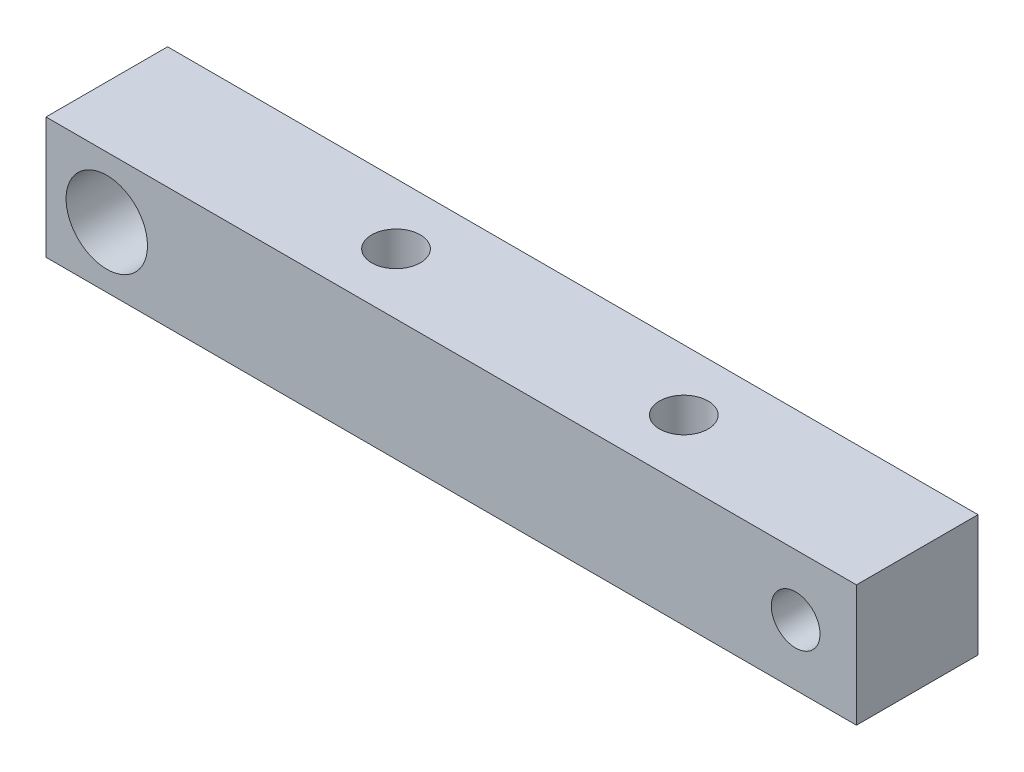
from build123d import *

# Parameters (mm, degrees)
SKETCH_1_W          = 100
SKETCH_1_H          = 15
SKETCH_1_R          = 3
SKETCH_1_R_2        = 5.021699513
EXTRUDE_1_DEPTH     = 15
CUT_EXTRUDE_1_REACH = 94.083
SKETCH_2_R          = 3


with BuildPart() as part:
    # 草圖1 → 填料-伸長1 (new body)
    with BuildSketch(Plane.XY):
        with Locations((39.606552155, 35.683485423)):
            Rectangle(SKETCH_1_W, SKETCH_1_H)
        with Locations((82.106552155, 35.683485423)):
            Circle(SKETCH_1_R, mode=Mode.SUBTRACT)
        with Locations((-2.893447845, 35.683485423)):
            Circle(SKETCH_1_R_2, mode=Mode.SUBTRACT)
    extrude(amount=EXTRUDE_1_DEPTH)

    # 草圖2 → 除料-伸長1 (cut, up to next)
    with BuildSketch(Plane.XZ.offset(-28.183485423), mode=Mode.PRIVATE) as cut_extrude_1_sk1:
        with Locations((60.806805045, 7.5)):
            Circle(SKETCH_2_R)
    cut_extrude_1_tool1 = extrude(cut_extrude_1_sk1.sketch, amount=-CUT_EXTRUDE_1_REACH, mode=Mode.PRIVATE) & part.part
    # 草圖2 → 除料-伸長1 (cut, up to next)
    with BuildSketch(Plane.XZ.offset(-28.183485423), mode=Mode.PRIVATE) as cut_extrude_1_sk2:
        with Locations((25.293048558, 7.5)):
            Circle(SKETCH_2_R)
    cut_extrude_1_tool2 = extrude(cut_extrude_1_sk2.sketch, amount=-CUT_EXTRUDE_1_REACH, mode=Mode.PRIVATE) & part.part
    add(cut_extrude_1_tool1.solids().sort_by_distance((60.806805, 28.183485, 7.5))[0], mode=Mode.SUBTRACT)
    add(cut_extrude_1_tool2.solids().sort_by_distance((25.293049, 28.183485, 7.5))[0], mode=Mode.SUBTRACT)


solid = part.part
